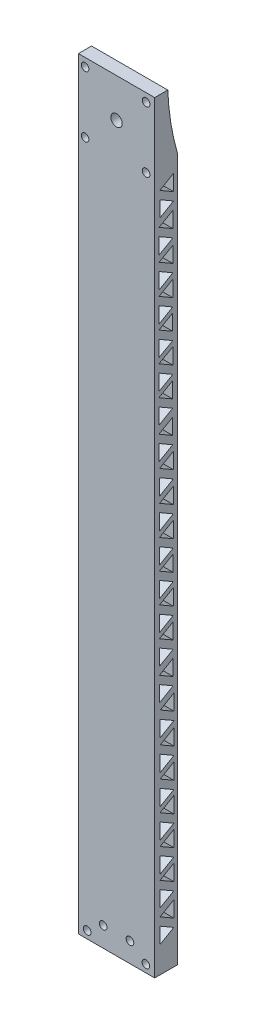
from build123d import *

# Parameters (mm, degrees)
SKETCH3_W           = 20
SKETCH3_H           = 6
BOSS_EXTRUDE1_DEPTH = 200
SKETCH7_R           = 1
SKETCH7_R_2         = 1.5
CUT_EXTRUDE1_DEPTH  = 200
CUT_EXTRUDE2_DEPTH  = 20


with BuildPart() as part:
    # Sketch3 → Boss-Extrude1 (new body)
    with BuildSketch(Plane(origin=(0, 0, 0), x_dir=(1, 0, 0), z_dir=(0, 1, 0))):
        with Locations((10, 3)):
            Rectangle(SKETCH3_W, SKETCH3_H)
    extrude(amount=BOSS_EXTRUDE1_DEPTH)

    # Sketch7 → Cut-Extrude1 (cut)
    with BuildSketch(Plane(origin=(0, 0, -6), x_dir=(-1, 0, 0), z_dir=(0, 0, -1))):
        with Locations((-17.73786558, 197.831954878)):
            Circle(SKETCH7_R)
        with Locations((-9.990864499, 189.820422053)):
            Circle(SKETCH7_R_2)
        with Locations((-1.73786558, 181.831954878)):
            Circle(SKETCH7_R)
        with Locations((-17.73786558, 181.831954878)):
            Circle(SKETCH7_R)
        with Locations((-1.73786558, 197.831954878)):
            Circle(SKETCH7_R)
        with Locations((-17.697443934, 1.992082172)):
            Circle(SKETCH7_R)
        with Locations((-13.512620359, 5.194753276)):
            Circle(SKETCH7_R)
        with Locations((-6.48, 5.194753276)):
            Circle(SKETCH7_R)
        with Locations((-2.3, 1.949379891)):
            Circle(SKETCH7_R)
    extrude(amount=-CUT_EXTRUDE1_DEPTH, mode=Mode.SUBTRACT)

    # Sketch8 → Cut-Extrude2 (cut)
    with BuildSketch(Plane.ZY):
        with BuildLine():
            Line((-3.435173621, 200.001787597), (-6.052585671, 200.001787597))
            Line((-6.052585671, 200.001787597), (-6.052585671, 184.116303831))
            ThreePointArc((-6.052585671, 184.116303831), (-4.253368373, 191.978225379), (-3.435173621, 200.001787597))
        make_face()
        Polygon((-5.013852098, 8.990026394), (-1.404702024, 6.906282628), (-1.404702024, 11.073770161), align=None)
        Polygon((-1.409675828, 13.185368824), (-5.018825902, 15.269112591), (-5.018825902, 11.101625057), align=None)
        Polygon((-5.006834199, 17.287599614), (-1.397684125, 15.203855847), (-1.397684125, 19.371343381), align=None)
        Polygon((-1.40265793, 21.482942044), (-5.011808004, 23.566685811), (-5.011808004, 19.399198277), align=None)
        Polygon((-4.848372599, 63.948540489), (-1.239222525, 61.864796722), (-1.239222525, 66.032284256), align=None)
        Polygon((-1.24419633, 68.143882919), (-4.853346404, 70.227626686), (-4.853346404, 66.060139152), align=None)
        Polygon((-5.03782653, 24.96562567), (-1.428676456, 22.881881903), (-1.428676456, 27.049369437), align=None)
        Polygon((-1.433650261, 29.1609681), (-5.042800335, 31.244711867), (-5.042800335, 27.077224333), align=None)
        Polygon((-5.013997563, 32.648394903), (-1.404847489, 30.564651136), (-1.404847489, 34.73213867), align=None)
        Polygon((-1.409821293, 36.843737333), (-5.018971367, 38.927481099), (-5.018971367, 34.759993566), align=None)
        Polygon((-5.031499061, 40.282604028), (-1.422348987, 38.198860261), (-1.422348987, 42.366347795), align=None)
        Polygon((-1.427322791, 44.477946458), (-5.036472865, 46.561690225), (-5.036472865, 42.394202691), align=None)
        Polygon((-5.062933803, 48.028503916), (-1.453783729, 45.944760149), (-1.453783729, 50.112247683), align=None)
        Polygon((-1.458757534, 52.223846346), (-5.067907608, 54.307590112), (-5.067907608, 50.140102579), align=None)
        Polygon((-5.064343036, 55.954978053), (-1.455192962, 53.871234286), (-1.455192962, 58.03872182), align=None)
        Polygon((-1.460166767, 60.150320483), (-5.069316841, 62.23406425), (-5.069316841, 58.066576716), align=None)
        Polygon((-4.841354701, 72.246113708), (-1.232204627, 70.162369942), (-1.232204627, 74.329857475), align=None)
        Polygon((-1.237178431, 76.441456138), (-4.846328505, 78.525199905), (-4.846328505, 74.357712372), align=None)
        Polygon((-4.872347032, 79.924139765), (-1.263196958, 77.840395998), (-1.263196958, 82.007883531), align=None)
        Polygon((-1.268170762, 84.119482194), (-4.877320836, 86.203225961), (-4.877320836, 82.035738428), align=None)
        Polygon((-4.848518064, 87.606908997), (-1.23936799, 85.523165231), (-1.23936799, 89.690652764), align=None)
        Polygon((-1.244341795, 91.802251427), (-4.853491869, 93.885995194), (-4.853491869, 89.71850766), align=None)
        Polygon((-4.866019563, 95.241118123), (-1.256869489, 93.157374356), (-1.256869489, 97.324861889), align=None)
        Polygon((-1.261843293, 99.436460552), (-4.870993367, 101.520204319), (-4.870993367, 97.352716786), align=None)
        Polygon((-4.897454305, 102.98701801), (-1.288304231, 100.903274244), (-1.288304231, 105.070761777), align=None)
        Polygon((-1.293278035, 107.18236044), (-4.902428109, 109.266104207), (-4.902428109, 105.098616674), align=None)
        Polygon((-4.898863538, 110.913492147), (-1.289713464, 108.829748381), (-1.289713464, 112.997235914), align=None)
        Polygon((-1.294687269, 115.108834577), (-4.903837343, 117.192578344), (-4.903837343, 113.025090811), align=None)
        Polygon((-4.725469308, 118.775061554), (-1.116319234, 116.691317787), (-1.116319234, 120.858805321), align=None)
        Polygon((-1.121293038, 122.970403984), (-4.730443112, 125.05414775), (-4.730443112, 120.886660217), align=None)
        Polygon((-4.71845141, 127.072634773), (-1.109301336, 124.988891007), (-1.109301336, 129.15637854), align=None)
        Polygon((-1.11427514, 131.267977203), (-4.723425214, 133.35172097), (-4.723425214, 129.184233436), align=None)
        Polygon((-4.749443741, 134.750660829), (-1.140293667, 132.666917063), (-1.140293667, 136.834404596), align=None)
        Polygon((-1.145267471, 138.946003259), (-4.754417545, 141.029747026), (-4.754417545, 136.862259493), align=None)
        Polygon((-4.725614773, 142.433430062), (-1.116464699, 140.349686295), (-1.116464699, 144.517173829), align=None)
        Polygon((-1.121438503, 146.628772492), (-4.730588577, 148.712516259), (-4.730588577, 144.545028725), align=None)
        Polygon((-4.743116271, 150.067639187), (-1.133966197, 147.983895421), (-1.133966197, 152.151382954), align=None)
        Polygon((-1.138940002, 154.262981617), (-4.748090076, 156.346725384), (-4.748090076, 152.179237851), align=None)
        Polygon((-4.774551014, 157.813539075), (-1.16540094, 155.729795309), (-1.16540094, 159.897282842), align=None)
        Polygon((-1.170374744, 162.008881505), (-4.779524818, 164.092625272), (-4.779524818, 159.925137738), align=None)
        Polygon((-4.775960247, 165.740013212), (-1.166810173, 163.656269446), (-1.166810173, 167.823756979), align=None)
        Polygon((-1.171783977, 169.935355642), (-4.780934051, 172.019099409), (-4.780934051, 167.851611875), align=None)
        Polygon((-4.95123506, 174.038440061), (-1.342084986, 171.954696294), (-1.342084986, 176.122183828), align=None)
        Polygon((-1.34705879, 178.233782491), (-4.956208864, 180.317526258), (-4.956208864, 176.150038724), align=None)
    extrude(amount=-CUT_EXTRUDE2_DEPTH, mode=Mode.SUBTRACT)


solid = part.part
